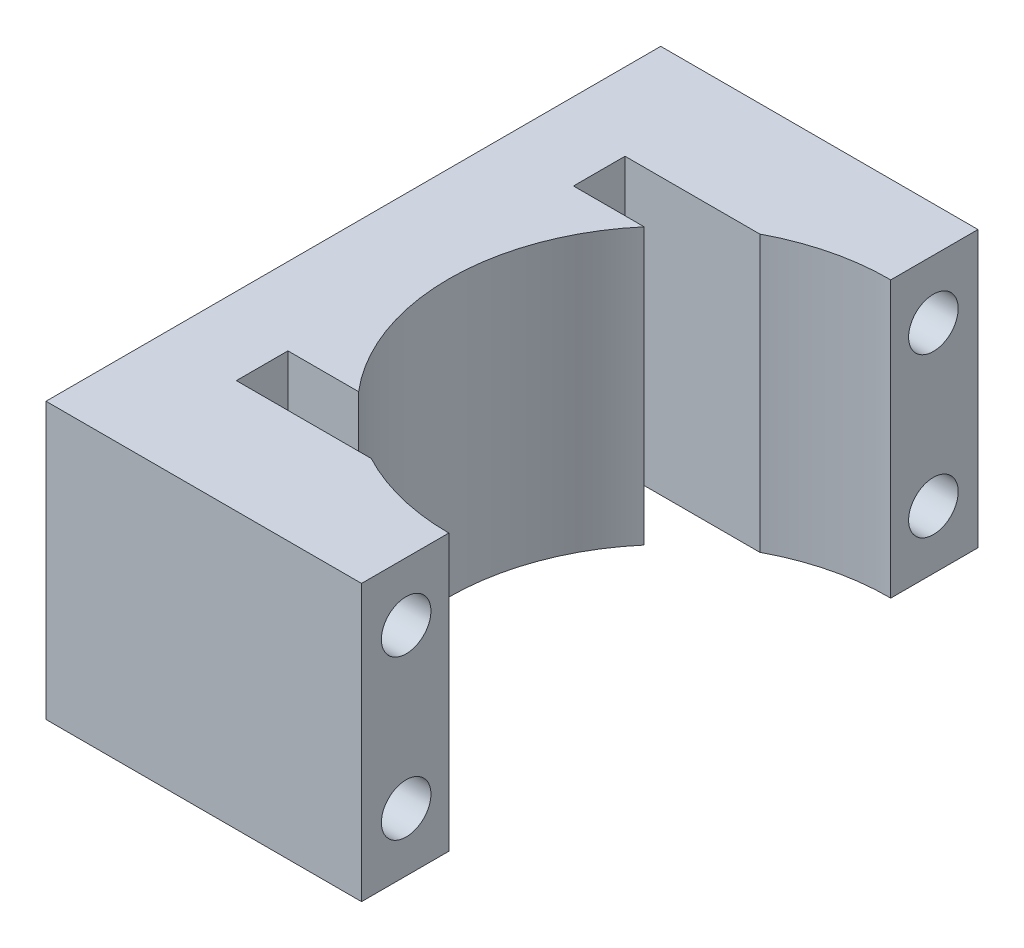
from build123d import *

# Parameters (mm, degrees)
EXTRUDE_1_DEPTH     = 13.9
SKETCH_2_R          = 1.25
CUT_EXTRUDE_1_DEPTH = 38.552762881


with BuildPart() as part:
    # 草图1 → 凸台-拉伸1 (new body)
    with BuildSketch(Plane(origin=(0, 0, 0), x_dir=(1, 0, 0), z_dir=(0, 1, 0))):
        with BuildLine():
            Line((0, 0), (15.912485012, 0))
            Line((15.912485012, 0), (15.912485012, 4.4))
            ThreePointArc((15.912485012, 4.4), (13.226409808, 4.729902507), (10.7, 5.7))
            Line((10.7, 5.7), (3.9, 5.7))
            Line((3.9, 5.7), (3.9, 8.3))
            Line((3.9, 8.3), (7.464408308, 8.3))
            ThreePointArc((7.464408308, 8.3), (4.812485012, 15.5), (7.464408308, 22.7))
            Line((7.464408308, 22.7), (3.9, 22.7))
            Line((3.9, 22.7), (3.9, 25.3))
            Line((3.9, 25.3), (10.7, 25.3))
            ThreePointArc((10.7, 25.3), (13.26888799, 26.28060271), (16, 26.599655))
            Line((16, 26.599655), (16, 31))
            Line((16, 31), (0, 31))
            Line((0, 31), (0, 0))
        make_face()
    extrude(amount=EXTRUDE_1_DEPTH)

    # 草图2 → 切除-拉伸1 (cut, through all)
    with BuildSketch(Plane.ZY):
        with Locations((-28.75, 10.95)):
            Circle(SKETCH_2_R)
        with Locations((-2.25, 10.95)):
            Circle(SKETCH_2_R)
        with Locations((-2.25, 2.95)):
            Circle(SKETCH_2_R)
        with Locations((-28.75, 2.95)):
            Circle(SKETCH_2_R)
    extrude(amount=-CUT_EXTRUDE_1_DEPTH, mode=Mode.SUBTRACT)


solid = part.part
